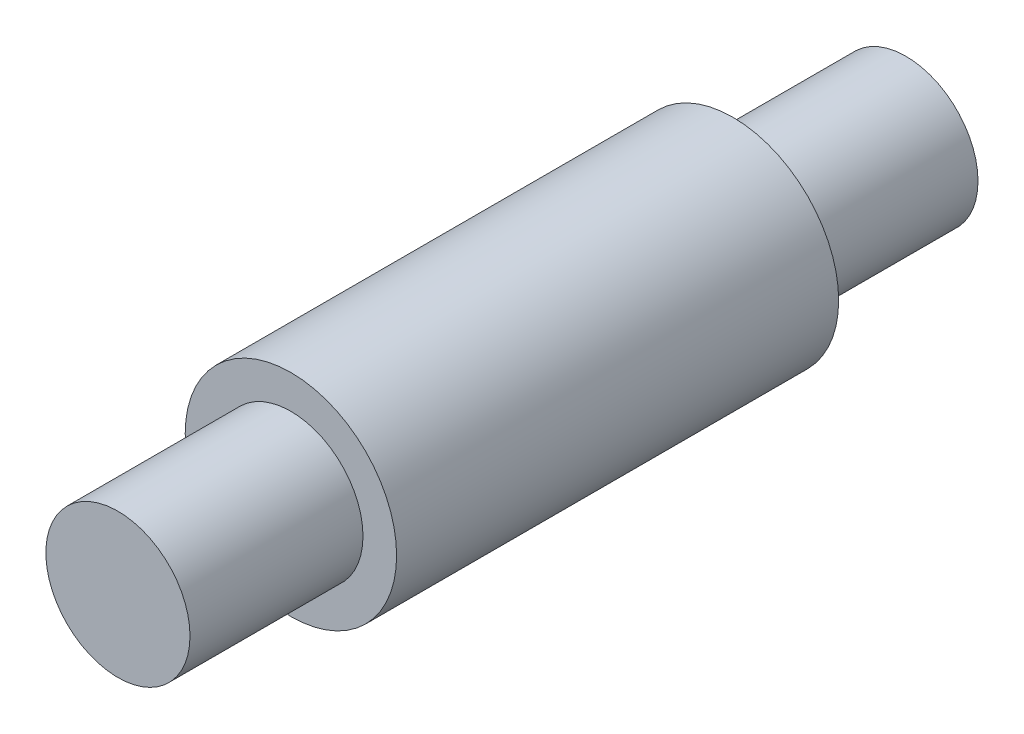
from build123d import *

# Parameters (mm, degrees)
SKETCH1_R           = 11
BOSS_EXTRUDE1_DEPTH = 23
SKETCH2_R           = 7.5
BOSS_EXTRUDE2_DEPTH = 18


with BuildPart() as part:
    # Sketch1 → Boss-Extrude1 (new, symmetric)
    with BuildSketch(Plane.XY):
        Circle(SKETCH1_R)
    extrude(amount=BOSS_EXTRUDE1_DEPTH, both=True)

    # Sketch2 → Boss-Extrude2 (add)
    with BuildSketch(Plane.XY.offset(23)):
        Circle(SKETCH2_R)
    boss_extrude2 = extrude(amount=BOSS_EXTRUDE2_DEPTH)

    # Mirror1: Boss-Extrude2 across plane
    add(boss_extrude2.mirror(Plane.XY))


solid = part.part
